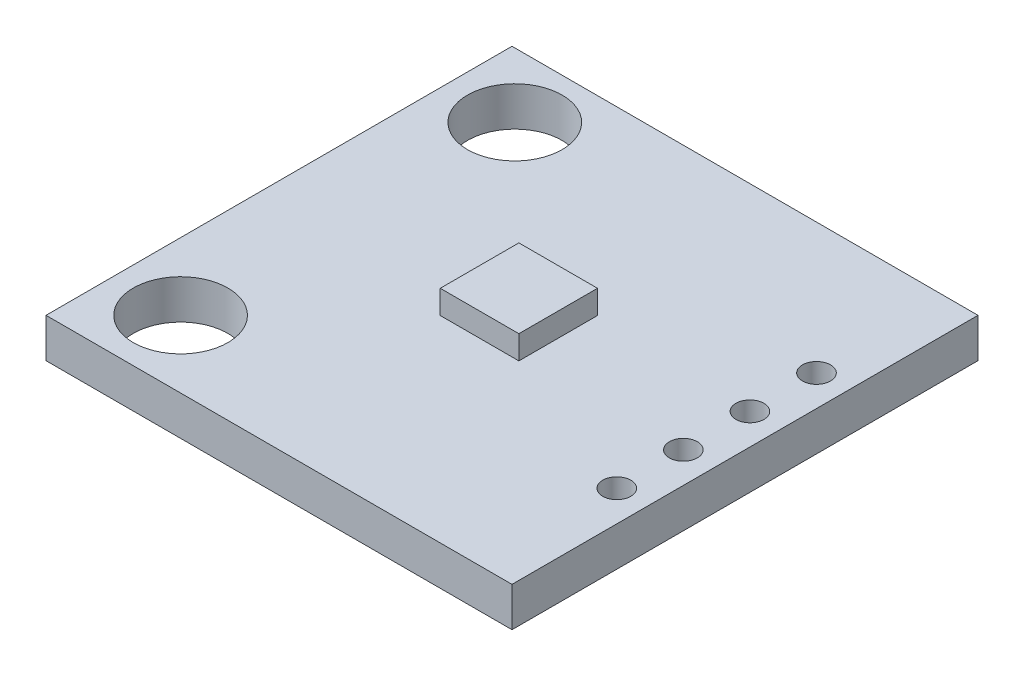
from build123d import *

# Parameters (mm, degrees)
SKETCH1_W           = 17.78
SKETCH1_H           = 17.78
BOSS_EXTRUDE1_DEPTH = 1.5
CUT_EXTRUDE1_REACH  = 51.33
SKETCH2_R           = 1.804631731
SKETCH2_R_2         = 0.534898854
SKETCH3_W           = 3
SKETCH3_H           = 3
BOSS_EXTRUDE2_DEPTH = 0.9


with BuildPart() as part:
    # Sketch1 → Boss-Extrude1 (new body)
    with BuildSketch(Plane(origin=(0, 0, 0), x_dir=(1, 0, 0), z_dir=(0, 1, 0))):
        with Locations((-20.939781645, -30.370993212)):
            Rectangle(SKETCH1_W, SKETCH1_H)
    extrude(amount=BOSS_EXTRUDE1_DEPTH)

    # Sketch2 → Cut-Extrude1 (cut, up to next)
    with BuildSketch(Plane(origin=(0, 1.5, 0), x_dir=(1, 0, 0), z_dir=(0, 1, 0)), mode=Mode.PRIVATE) as cut_extrude1_sk1:
        with Locations(Location((-27.262286101, -23.941508984, 0), (0, 0, 270))):
            Circle(SKETCH2_R)
    cut_extrude1_tool1 = extrude(cut_extrude1_sk1.sketch, amount=-CUT_EXTRUDE1_REACH, mode=Mode.PRIVATE) & part.part
    # Sketch2 → Cut-Extrude1 (cut, up to next)
    with BuildSketch(Plane(origin=(0, 1.5, 0), x_dir=(1, 0, 0), z_dir=(0, 1, 0)), mode=Mode.PRIVATE) as cut_extrude1_sk2:
        with Locations(Location((-27.262286101, -36.693497669, 0), (0, 0, 270))):
            Circle(SKETCH2_R)
    cut_extrude1_tool2 = extrude(cut_extrude1_sk2.sketch, amount=-CUT_EXTRUDE1_REACH, mode=Mode.PRIVATE) & part.part
    # Sketch2 → Cut-Extrude1 (cut, up to next)
    with BuildSketch(Plane(origin=(0, 1.5, 0), x_dir=(1, 0, 0), z_dir=(0, 1, 0)), mode=Mode.PRIVATE) as cut_extrude1_sk3:
        with Locations(Location((-13.226540167, -26.466231576, 0), (0, 0, 270))):
            Circle(SKETCH2_R_2)
    cut_extrude1_tool3 = extrude(cut_extrude1_sk3.sketch, amount=-CUT_EXTRUDE1_REACH, mode=Mode.PRIVATE) & part.part
    # Sketch2 → Cut-Extrude1 (cut, up to next)
    with BuildSketch(Plane(origin=(0, 1.5, 0), x_dir=(1, 0, 0), z_dir=(0, 1, 0)), mode=Mode.PRIVATE) as cut_extrude1_sk4:
        with Locations(Location((-13.226540167, -29.006231576, 0), (0, 0, 270))):
            Circle(SKETCH2_R_2)
    cut_extrude1_tool4 = extrude(cut_extrude1_sk4.sketch, amount=-CUT_EXTRUDE1_REACH, mode=Mode.PRIVATE) & part.part
    # Sketch2 → Cut-Extrude1 (cut, up to next)
    with BuildSketch(Plane(origin=(0, 1.5, 0), x_dir=(1, 0, 0), z_dir=(0, 1, 0)), mode=Mode.PRIVATE) as cut_extrude1_sk5:
        with Locations(Location((-13.226540167, -31.546231576, 0), (0, 0, 270))):
            Circle(SKETCH2_R_2)
    cut_extrude1_tool5 = extrude(cut_extrude1_sk5.sketch, amount=-CUT_EXTRUDE1_REACH, mode=Mode.PRIVATE) & part.part
    # Sketch2 → Cut-Extrude1 (cut, up to next)
    with BuildSketch(Plane(origin=(0, 1.5, 0), x_dir=(1, 0, 0), z_dir=(0, 1, 0)), mode=Mode.PRIVATE) as cut_extrude1_sk6:
        with Locations(Location((-13.226540167, -34.086231576, 0), (0, 0, 270))):
            Circle(SKETCH2_R_2)
    cut_extrude1_tool6 = extrude(cut_extrude1_sk6.sketch, amount=-CUT_EXTRUDE1_REACH, mode=Mode.PRIVATE) & part.part
    add(cut_extrude1_tool1.solids().sort_by_distance((-27.262286, 1.5, 23.941509))[0], mode=Mode.SUBTRACT)
    add(cut_extrude1_tool2.solids().sort_by_distance((-27.262286, 1.5, 36.693498))[0], mode=Mode.SUBTRACT)
    add(cut_extrude1_tool3.solids().sort_by_distance((-13.22654, 1.5, 26.466232))[0], mode=Mode.SUBTRACT)
    add(cut_extrude1_tool4.solids().sort_by_distance((-13.22654, 1.5, 29.006232))[0], mode=Mode.SUBTRACT)
    add(cut_extrude1_tool5.solids().sort_by_distance((-13.22654, 1.5, 31.546232))[0], mode=Mode.SUBTRACT)
    add(cut_extrude1_tool6.solids().sort_by_distance((-13.22654, 1.5, 34.086232))[0], mode=Mode.SUBTRACT)

    # Sketch3 → Boss-Extrude2 (add)
    with BuildSketch(Plane(origin=(0, 1.5, 0), x_dir=(1, 0, 0), z_dir=(0, 1, 0))):
        with Locations((-20.801462442, -30.247030068)):
            Rectangle(SKETCH3_W, SKETCH3_H)
    extrude(amount=BOSS_EXTRUDE2_DEPTH)


solid = part.part
